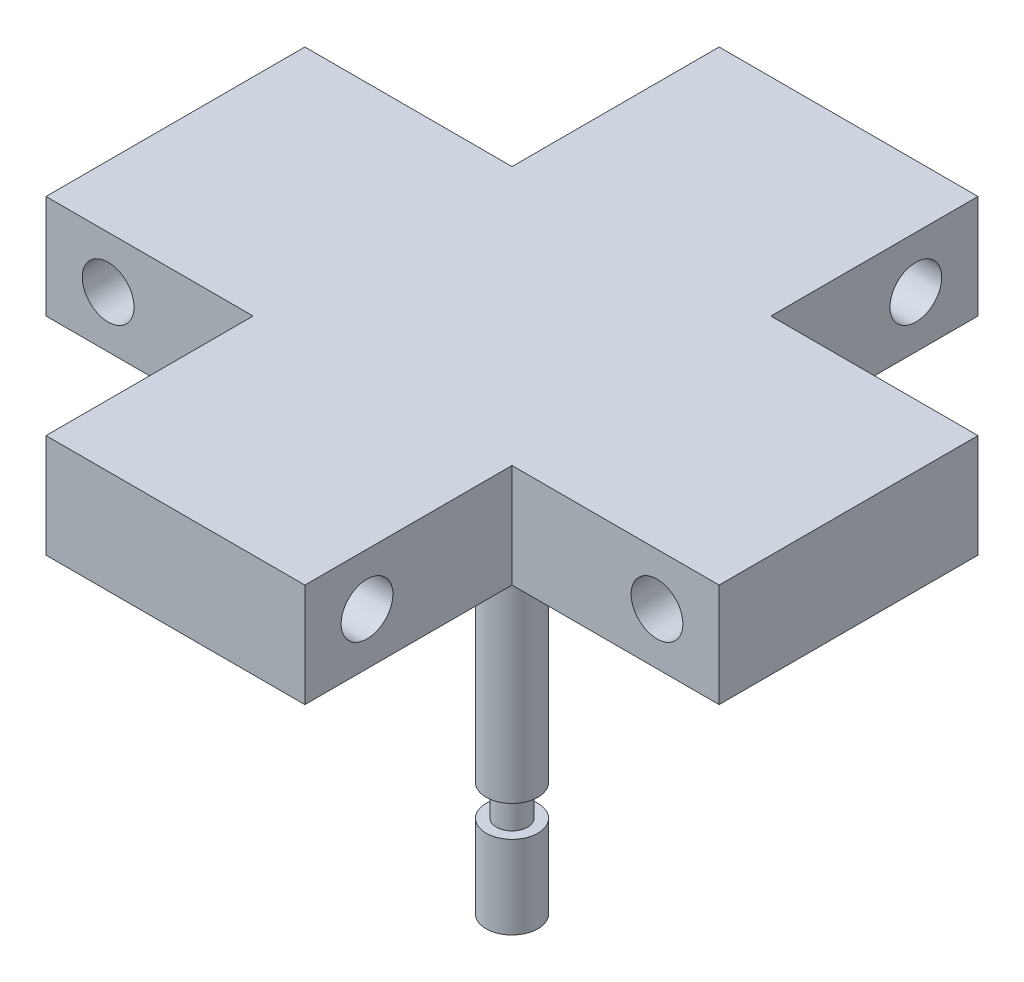
from build123d import *

# Parameters (mm, degrees)
SKETCH1_W           = 20
SKETCH1_H           = 25
SKETCH1_W_2         = 25
SKETCH1_H_2         = 20
BOSS_EXTRUDE1_DEPTH = 10
SKETCH2_R           = 2.5
CUT_EXTRUDE1_DEPTH  = 57.402570863
SKETCH3_R           = 2.5
CUT_EXTRUDE2_DEPTH  = 57.402570863
SKETCH4_R           = 2.5
BOSS_EXTRUDE2_DEPTH = 40
SKETCH5_W           = 1
SKETCH5_H           = 3


with BuildPart() as part:
    # Sketch1 → Boss-Extrude1 (new body)
    with BuildSketch(Plane(origin=(0, 0, 0), x_dir=(1, 0, 0), z_dir=(0, 1, 0))):
        with Locations((-22.5, 0)):
            Rectangle(SKETCH1_W, SKETCH1_H)
        with Locations((0, -22.5)):
            Rectangle(SKETCH1_W_2, SKETCH1_H_2)
        Rectangle(SKETCH1_W_2, SKETCH1_H)
        with Locations((0, 22.5)):
            Rectangle(SKETCH1_W_2, SKETCH1_H_2)
        with Locations((22.5, 0)):
            Rectangle(SKETCH1_W, SKETCH1_H)
    extrude(amount=BOSS_EXTRUDE1_DEPTH)

    # Sketch2 → Cut-Extrude1 (cut, through all)
    with BuildSketch(Plane(origin=(12.5, 0, 0), x_dir=(0, 0, -1), z_dir=(1, 0, 0))):
        with Locations((-26.499999999, 5)):
            Circle(SKETCH2_R)
        with Locations((26.499999999, 5)):
            Circle(SKETCH2_R)
    extrude(amount=-CUT_EXTRUDE1_DEPTH, mode=Mode.SUBTRACT)

    # Sketch3 → Cut-Extrude2 (cut, through all)
    with BuildSketch(Plane.XY.offset(12.5)):
        with Locations((26.5, 5)):
            Circle(SKETCH3_R)
        with Locations((-26.5, 5)):
            Circle(SKETCH3_R)
    extrude(amount=-CUT_EXTRUDE2_DEPTH, mode=Mode.SUBTRACT)

    # Sketch4 → Boss-Extrude2 (add)
    with BuildSketch(Plane(origin=(0, 0, 0), x_dir=(1, 0, 0), z_dir=(0, 1, 0))):
        with Locations(Location((0, 0, 0), (0, 0, 270))):
            Circle(SKETCH4_R)
    extrude(amount=-BOSS_EXTRUDE2_DEPTH)

    # Sketch5 → Cut-Revolve1 (revolve, cut)
    with BuildSketch(Plane(origin=(0, 0, 0), x_dir=(0, 0, -1), z_dir=(1, 0, 0)), mode=Mode.PRIVATE) as cut_revolve1_sk:
        with Locations((2, -30.5)):
            Rectangle(SKETCH5_W, SKETCH5_H)
    revolve(cut_revolve1_sk.sketch.rotate(Axis((0, 0, 0), (0, -1, 0)), 180), axis=Axis((0, 0, 0), (0, -1, 0)), mode=Mode.SUBTRACT)


solid = part.part
